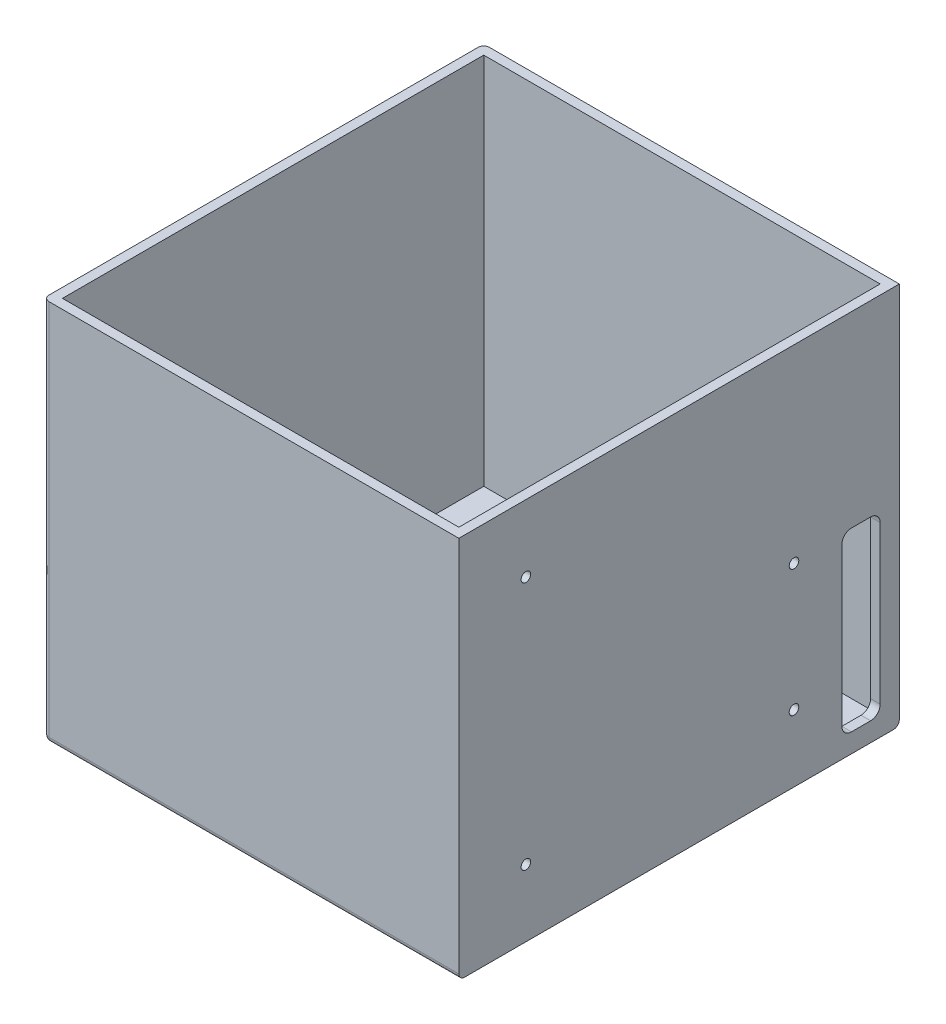
from build123d import *

# Parameters (mm, degrees)
SKETCH1_W           = 217
SKETCH1_H           = 230
BOSS_EXTRUDE1_DEPTH = 200
SKETCH2_W           = 207
SKETCH2_H           = 220
CUT_EXTRUDE1_DEPTH  = 195
FILLET1_R           = 3
CUT_EXTRUDE2_DEPTH  = 5
CUT_EXTRUDE3_DEPTH  = 10


with BuildPart() as part:
    # Sketch1 → Boss-Extrude1 (new body)
    with BuildSketch(Plane(origin=(0, 0, 0), x_dir=(1, 0, 0), z_dir=(0, 1, 0))):
        with Locations((8.797297297, -25.267567568)):
            Rectangle(SKETCH1_W, SKETCH1_H)
    extrude(amount=BOSS_EXTRUDE1_DEPTH)

    # Sketch2 → Cut-Extrude1 (cut)
    with BuildSketch(Plane(origin=(0, 200, 0), x_dir=(1, 0, 0), z_dir=(0, 1, 0))):
        with Locations((8.797297297, -25.267567568)):
            Rectangle(SKETCH2_W, SKETCH2_H)
    extrude(amount=-CUT_EXTRUDE1_DEPTH, mode=Mode.SUBTRACT)

    # Fillet1
    fillet1_edges = [part.edges().sort_by_distance(p)[0] for p in [
        (8.797297297, 0, -89.732432432),
        (8.797297297, 0, 140.267567568),
        (-99.702702703, 0, 25.267567568),
        (-99.702702703, 100, -89.732432432),
        (-99.702702703, 100, 140.267567568),
    ]]
    fillet(fillet1_edges, radius=FILLET1_R)

    # Sketch3 → Cut-Extrude2 (cut)
    with BuildSketch(Plane(origin=(117.297297297, 0, 0), x_dir=(0, 0, -1), z_dir=(1, 0, 0))):
        with BuildLine():
            ThreePointArc((-105.267567568, 162.5), (-103.499800615, 163.232233047), (-102.767567568, 165))
            Line((-102.767567568, 165), (-105.267567568, 165))
            Line((-105.267567568, 165), (-105.267567568, 162.5))
        make_face()
        with BuildLine():
            Line((-105.267567568, 165), (-102.767567568, 165))
            ThreePointArc((-102.767567568, 165), (-107.035334521, 166.767766953), (-105.267567568, 162.5))
            Line((-105.267567568, 162.5), (-105.267567568, 165))
        make_face()
        with BuildLine():
            ThreePointArc((-105.267567568, 37.5), (-107.035334521, 33.232233047), (-102.767567568, 35))
            Line((-102.767567568, 35), (-105.267567568, 35))
            Line((-105.267567568, 35), (-105.267567568, 37.5))
        make_face()
        with BuildLine():
            Line((-105.267567568, 35), (-102.767567568, 35))
            ThreePointArc((-102.767567568, 35), (-103.499800615, 36.767766953), (-105.267567568, 37.5))
            Line((-105.267567568, 37.5), (-105.267567568, 35))
        make_face()
        with BuildLine():
            ThreePointArc((37.232432432, 35), (36.500199385, 36.767766953), (34.732432432, 37.5))
            Line((34.732432432, 37.5), (34.732432432, 35))
            Line((34.732432432, 35), (32.232432432, 35))
            ThreePointArc((32.232432432, 35), (34.732432432, 32.5), (37.232432432, 35))
        make_face()
        with BuildLine():
            Line((34.732432432, 35), (34.732432432, 37.5))
            ThreePointArc((34.732432432, 37.5), (32.964665479, 36.767766953), (32.232432432, 35))
            Line((32.232432432, 35), (34.732432432, 35))
        make_face()
        with BuildLine():
            Line((32.56180467, 102.425143832), (34.732432432, 101.184831324))
            Line((34.732432432, 101.184831324), (34.732432432, 98.684831324))
            ThreePointArc((34.732432432, 98.684831324), (36.500199385, 99.417064371), (37.232432432, 101.184831324))
            ThreePointArc((37.232432432, 101.184831324), (35.37408288, 103.601085595), (32.56180467, 102.425143832))
        make_face()
        with BuildLine():
            Line((34.732432432, 98.684831324), (34.732432432, 101.184831324))
            Line((34.732432432, 101.184831324), (32.56180467, 102.425143832))
            ThreePointArc((32.56180467, 102.425143832), (32.570167269, 99.929996927), (34.732432432, 98.684831324))
        make_face()
    extrude(amount=-CUT_EXTRUDE2_DEPTH, mode=Mode.SUBTRACT)

    # Sketch4 → Cut-Extrude3 (cut)
    with BuildSketch(Plane(origin=(117.297297297, 0, 0), x_dir=(0, 0, -1), z_dir=(1, 0, 0))):
        with BuildLine():
            Line((64.732432432, 102.133518404), (74.732432432, 102.133518404))
            ThreePointArc((74.732432432, 102.133518404), (78.267966338, 100.66905231), (79.732432432, 97.133518404))
            Line((79.732432432, 97.133518404), (79.732432432, 14.966834817))
            ThreePointArc((79.732432432, 14.966834817), (78.267966338, 11.431300911), (74.732432432, 9.966834817))
            Line((74.732432432, 9.966834817), (64.732432432, 9.966834817))
            ThreePointArc((64.732432432, 9.966834817), (61.196898526, 11.431300911), (59.732432432, 14.966834817))
            Line((59.732432432, 14.966834817), (59.732432432, 97.133518404))
            ThreePointArc((59.732432432, 97.133518404), (61.196898526, 100.66905231), (64.732432432, 102.133518404))
        make_face()
    extrude(amount=-CUT_EXTRUDE3_DEPTH, mode=Mode.SUBTRACT)


solid = part.part
